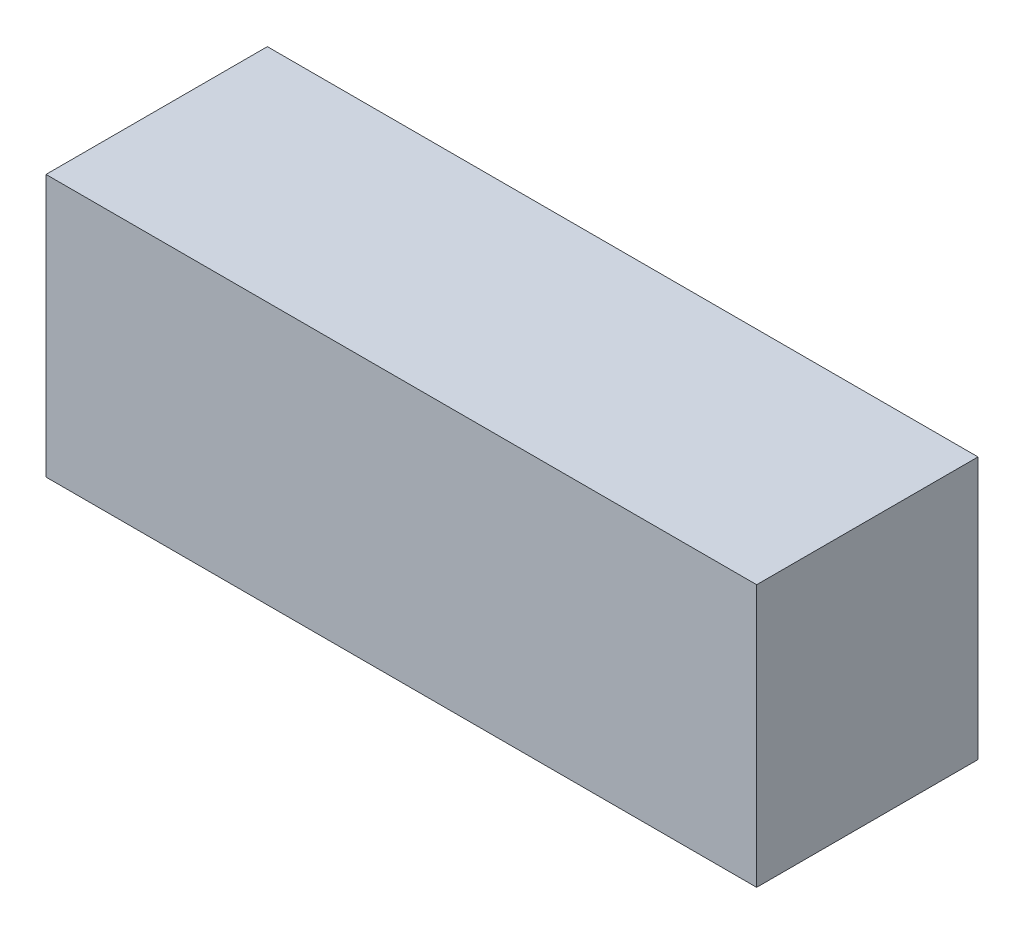
from build123d import *

# Parameters (mm, degrees)
SKETCH1_W           = 12.2
SKETCH1_H           = 3.8
BOSS_EXTRUDE1_DEPTH = 4.5


with BuildPart() as part:
    # Sketch1 → Boss-Extrude1 (new body)
    with BuildSketch(Plane(origin=(0, 0, 0), x_dir=(1, 0, 0), z_dir=(0, 1, 0))):
        with Locations((-6.6, 1.9)):
            Rectangle(SKETCH1_W, SKETCH1_H)
    extrude(amount=BOSS_EXTRUDE1_DEPTH)


solid = part.part
